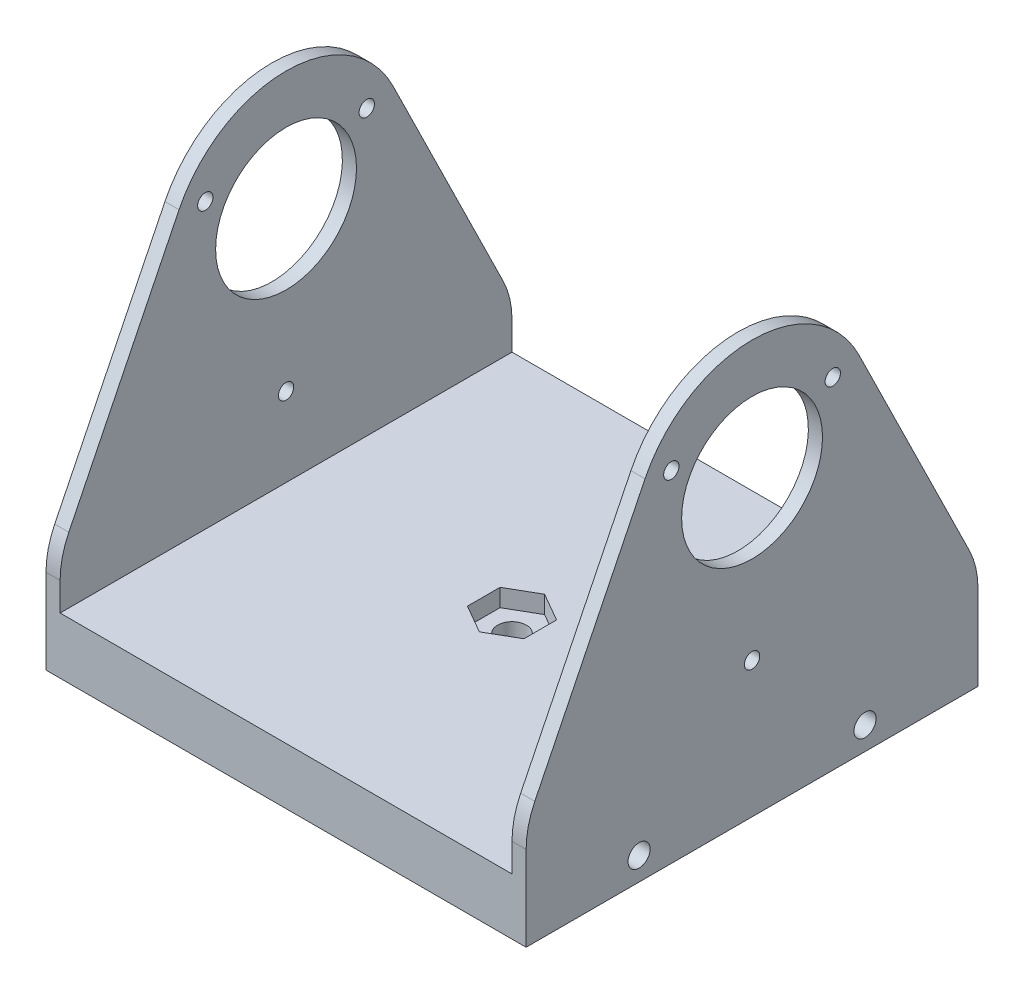
from build123d import *
from build123d.topology import SkipClean

# Parameters (mm, degrees)
BOSS_EXTRUDE1_DEPTH               = 101.6
SKETCH3_R                         = 5.87375
CUT_EXTRUDE1_DEPTH                = 168.856337682
BOSS_EXTRUDE3_DEPTH               = 3.175
CUT_EXTRUDE2_DEPTH                = 3.96875
SKETCH5_R                         = 3.2385
CUT_EXTRUDE3_DEPTH                = 171.445522471
BOSS_EXTRUDE4_START               = -3.175
SKETCH7_R                         = 26.8097
SKETCH7_R_2                       = 5.87375
BOSS_EXTRUDE4_DEPTH               = 3.175
SKETCH6_R                         = 1.7272
CUT_EXTRUDE4_DEPTH                = 175.91949374
SKETCH8_W                         = 12.7
SKETCH8_H                         = 12.7
SKETCH8_R                         = 3.2385
BOSS_EXTRUDE5_DEPTH               = 12.7
CUT_EXTRUDE5_DEPTH                = 175.91949374
CUT_EXTRUDE5_DEPTH_BACK           = 175.91949374
SKETCH10_R                        = 15.8369
SKETCH13_W                        = 4.8895
SKETCH13_H                        = 11.125454
CUT_EXTRUDE7_DEPTH                = 9.8425
F_10_0_1935_DIAMETER_HOLE1_REACH  = 160.559
F_10_0_1935_DIAMETER_HOLE1_BORE_R = 2.48285


with BuildPart() as part:
    # Sketch2 → Boss-Extrude1 (new body)
    with BuildSketch(Plane.XY):
        Polygon((0, 78.74), (0, 0), (107.95, 0), (107.95, 78.74), (104.775, 78.74), (104.775, 12.7), (3.175, 12.7), (3.175, 78.74), align=None)
    extrude(amount=BOSS_EXTRUDE1_DEPTH)

    # Sketch3 → Cut-Extrude1 (cut, through all)
    with BuildSketch(Plane.ZY):
        with BuildLine():
            ThreePointArc((0, 19.05), (0.495062251, 23.364717272), (1.954518124, 27.455176943))
            Line((1.954518124, 27.455176943), (26.740958507, 77.868885684))
            ThreePointArc((26.740958507, 77.868885684), (26.961098465, 78.306490439), (27.189197089, 78.74))
            Line((27.189197089, 78.74), (0, 78.74))
            Line((0, 78.74), (0, 19.05))
        make_face()
        with BuildLine():
            Line((101.6, 78.74), (74.410802911, 78.74))
            ThreePointArc((74.410802911, 78.74), (74.638901535, 78.306490439), (74.859041493, 77.868885684))
            Line((74.859041493, 77.868885684), (99.645481876, 27.455176943))
            ThreePointArc((99.645481876, 27.455176943), (101.104937749, 23.364717272), (101.6, 19.05))
            Line((101.6, 19.05), (101.6, 78.74))
        make_face()
        with Locations(Location((50.8, 66.04, 0), (0, 0, 270))):
            Circle(SKETCH3_R)
    extrude(amount=-CUT_EXTRUDE1_DEPTH, mode=Mode.SUBTRACT)

    # Sketch3<4> → Boss-Extrude3 (add)
    with SkipClean():  # the faces are left unmerged after this step: merging them gives an invalid solid
        with BuildSketch(Plane.ZY):
            with BuildLine():
                ThreePointArc((74.410802911, 78.74), (50.8, 92.8497), (27.189197089, 78.74))
                Line((27.189197089, 78.74), (74.410802911, 78.74))
            make_face()
        extrude(amount=-BOSS_EXTRUDE3_DEPTH)

    # Sketch4 → Cut-Extrude2 (cut)
    with SkipClean():  # the faces are left unmerged after this step: merging them gives an invalid solid
        with BuildSketch(Plane(origin=(0, 12.7, 0), x_dir=(1, 0, 0), z_dir=(0, 1, 0))):
            Polygon((60.325, -47.133825791), (53.975, -43.467651581), (47.625, -47.133825791), (47.625, -54.466174209), (53.975, -58.132348419), (60.325, -54.466174209), align=None)
        extrude(amount=-CUT_EXTRUDE2_DEPTH, mode=Mode.SUBTRACT)

    # Sketch5 → Cut-Extrude3 (cut, through all)
    with SkipClean():  # the faces are left unmerged after this step: merging them gives an invalid solid
        with BuildSketch(Plane(origin=(0, 8.73125, 0), x_dir=(1, 0, 0), z_dir=(0, 1, 0))):
            with Locations(Location((53.975, -50.8, 0), (0, 0, 180))):
                Circle(SKETCH5_R)
        extrude(amount=-CUT_EXTRUDE3_DEPTH, mode=Mode.SUBTRACT)

    # Sketch7 → Boss-Extrude4 (add)
    with SkipClean():  # the faces are left unmerged after this step: merging them gives an invalid solid
        with BuildSketch(Plane(origin=(107.95, 0, 0), x_dir=(0, 0, -1), z_dir=(1, 0, 0)).offset(BOSS_EXTRUDE4_START)):
            with Locations((-50.8, 66.04)):
                Circle(SKETCH7_R)
            with Locations(Location((-50.8, 66.04, 0), (0, 0, 270))):
                Circle(SKETCH7_R_2, mode=Mode.SUBTRACT)
        extrude(amount=BOSS_EXTRUDE4_DEPTH)

    # Sketch6 → Cut-Extrude4 (cut, through all)
    with SkipClean():  # the faces are left unmerged after this step: merging them gives an invalid solid
        with BuildSketch(Plane.ZY):
            with Locations(Location((32.65297, 76.5175, 0), (0, 0, 270))):
                Circle(SKETCH6_R)
            with Locations(Location((68.94703, 76.5175, 0), (0, 0, 270))):
                Circle(SKETCH6_R)
            with Locations(Location((50.8, 30.480783465, 0), (0, 0, 270))):
                Circle(SKETCH6_R)
        extrude(amount=-CUT_EXTRUDE4_DEPTH, mode=Mode.SUBTRACT)

    # Sketch8 → Boss-Extrude5 (add)
    with SkipClean():  # the faces are left unmerged after this step: merging them gives an invalid solid
        with BuildSketch(Plane.XZ):
            with Locations((53.975, 50.8)):
                Rectangle(SKETCH8_W, SKETCH8_H)
            with Locations(Location((53.975, 50.8, 0), (0, 0, 180))):
                Circle(SKETCH8_R, mode=Mode.SUBTRACT)
        extrude(amount=BOSS_EXTRUDE5_DEPTH)

    # Sketch9 → Revolve1 (revolve)
    with SkipClean():  # the faces are left unmerged after this step: merging them gives an invalid solid
        with BuildSketch(Plane.ZY.offset(-53.975), mode=Mode.PRIVATE) as revolve1_sk:
            Polygon((44.45, -12.7), (44.45, 0), (31.75, 0), (41.3385, -12.7), align=None)
        revolve(revolve1_sk.sketch.rotate(Axis((53.975, -12.7, 50.8), (0, 1, 0)), 90), axis=Axis((53.975, -12.7, 50.8), (0, 1, 0)))

    # Sketch10 → Cut-Extrude5 (cut, two sides: drawn at the far end of the back side and taken through both)
    with SkipClean():  # the faces are left unmerged after this step: merging them gives an invalid solid
        with BuildSketch(Plane(origin=(107.95, 0, 0), x_dir=(0, 0, -1), z_dir=(1, 0, 0)).offset(-CUT_EXTRUDE5_DEPTH_BACK)):
            with Locations(Location((-50.8, 66.04, 0), (0, 0, 90))):
                Circle(SKETCH10_R)
        extrude(amount=CUT_EXTRUDE5_DEPTH + CUT_EXTRUDE5_DEPTH_BACK, mode=Mode.SUBTRACT)

    # Sketch13 → Cut-Extrude7 (cut)
    with SkipClean():  # the faces are left unmerged after this step: merging them gives an invalid solid
        with BuildSketch(Plane.XZ):
            with Locations((90.83675, 76.2)):
                Rectangle(SKETCH13_W, SKETCH13_H)
            with Locations((90.83675, 25.4)):
                Rectangle(SKETCH13_W, SKETCH13_H)
        cut_extrude7 = extrude(amount=-CUT_EXTRUDE7_DEPTH, mode=Mode.SUBTRACT)

    # #10 (0.1935) Diameter Hole1 bore (on position points) → #10 (0.1935) Diameter Hole1 (cut, up to next)
    with BuildSketch(Plane(origin=(107.95, 5.207, 76.2), x_dir=(0, 1, 0), z_dir=(1, 0, 0)), mode=Mode.PRIVATE) as f_10_0_1935_diameter_hole1_sk1:
        Circle(F_10_0_1935_DIAMETER_HOLE1_BORE_R)
    f_10_0_1935_diameter_hole1_tool1 = extrude(f_10_0_1935_diameter_hole1_sk1.sketch, amount=-F_10_0_1935_DIAMETER_HOLE1_REACH, mode=Mode.PRIVATE) & part.part
    # #10 (0.1935) Diameter Hole1 bore (on position points) → #10 (0.1935) Diameter Hole1 (cut, up to next)
    with BuildSketch(Plane(origin=(107.95, 5.207, 76.2), x_dir=(0, 1, 0), z_dir=(1, 0, 0)), mode=Mode.PRIVATE) as f_10_0_1935_diameter_hole1_sk2:
        with Locations((0, -50.8)):
            Circle(F_10_0_1935_DIAMETER_HOLE1_BORE_R)
    f_10_0_1935_diameter_hole1_tool2 = extrude(f_10_0_1935_diameter_hole1_sk2.sketch, amount=-F_10_0_1935_DIAMETER_HOLE1_REACH, mode=Mode.PRIVATE) & part.part
    f_10_0_1935_diameter_hole1_1 = f_10_0_1935_diameter_hole1_tool1.solids().sort_by_distance((107.95, 5.207, 76.2))[0]
    add(f_10_0_1935_diameter_hole1_1, mode=Mode.SUBTRACT)
    f_10_0_1935_diameter_hole1_2 = f_10_0_1935_diameter_hole1_tool2.solids().sort_by_distance((107.95, 5.207, 25.4))[0]
    add(f_10_0_1935_diameter_hole1_2, mode=Mode.SUBTRACT)
    f_10_0_1935_diameter_hole1 = f_10_0_1935_diameter_hole1_1 + f_10_0_1935_diameter_hole1_2  # #10 (0.1935) Diameter Hole1 as one shape, for the pattern or mirror that repeats it

    # Mirror2: Cut-Extrude7, #10 (0.1935) Diameter Hole1 across plane
    with SkipClean():  # the faces are left unmerged after this step: merging them gives an invalid solid
        add(cut_extrude7.mirror(Plane(origin=(53.975, 0, 0), x_dir=(0, 0, 1), z_dir=(1, 0, 0))), mode=Mode.SUBTRACT)
        add(f_10_0_1935_diameter_hole1.mirror(Plane(origin=(53.975, 0, 0), x_dir=(0, 0, 1), z_dir=(1, 0, 0))), mode=Mode.SUBTRACT)


solid = part.part
